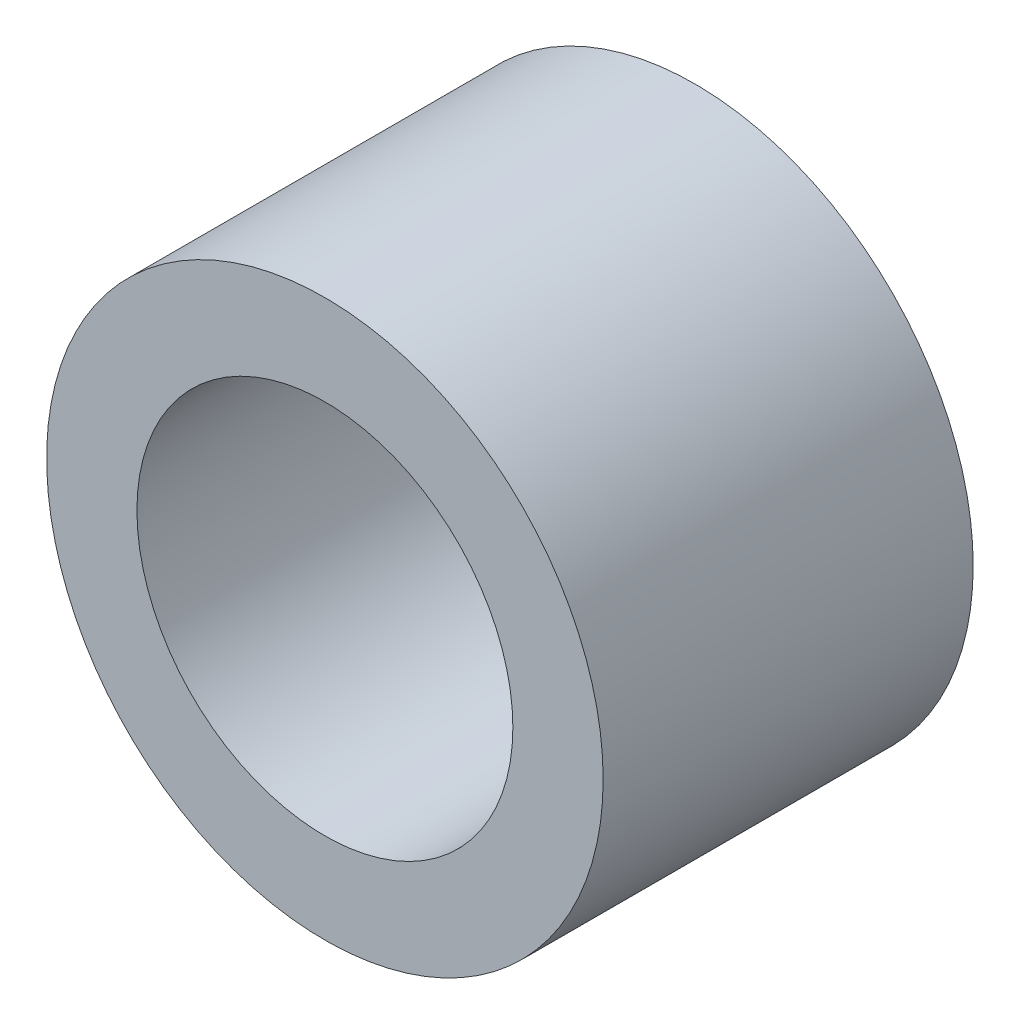
from build123d import *

# Parameters (mm, degrees)
SKETCH1_R      = 4.7752
SKETCH1_R_2    = 3.2258
EXTRUDE1_DEPTH = 3.175


with BuildPart() as part:
    # Sketch1 → Extrude1 (new, symmetric)
    with BuildSketch(Plane.XY):
        Circle(SKETCH1_R)
        Circle(SKETCH1_R_2, mode=Mode.SUBTRACT)
    extrude(amount=EXTRUDE1_DEPTH, both=True)


solid = part.part
